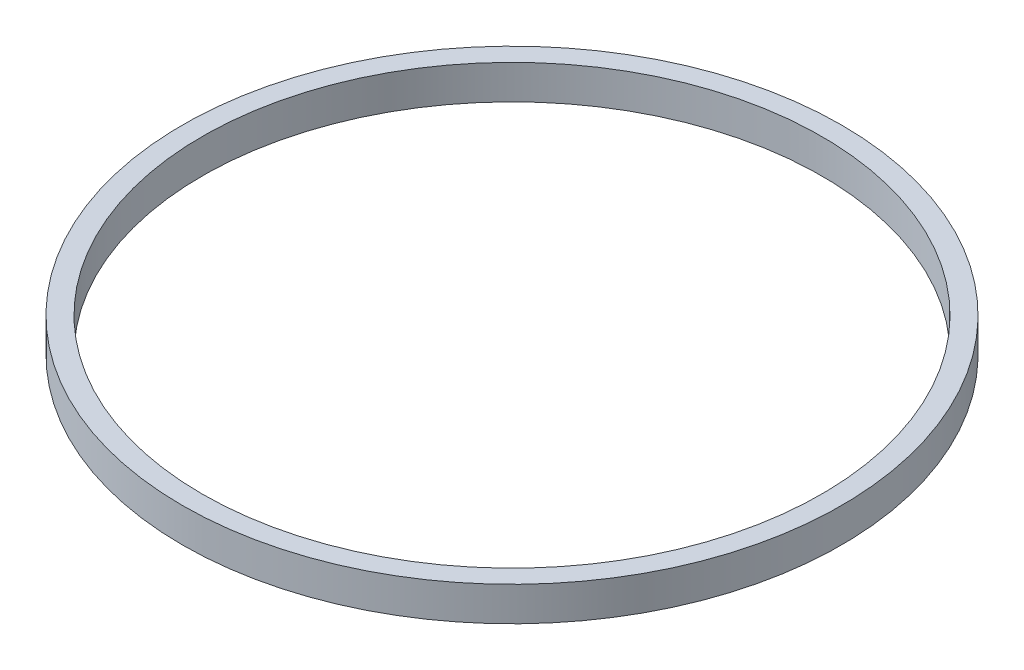
from build123d import *

# Parameters (mm, degrees)
SKETCH1_R           = 183
SKETCH1_R_2         = 172
BOSS_EXTRUDE1_DEPTH = 9.5


with BuildPart() as part:
    # Sketch1 → Boss-Extrude1 (new, symmetric)
    with BuildSketch(Plane(origin=(0, 0, 0), x_dir=(1, 0, 0), z_dir=(0, 1, 0))):
        with Locations(Location((0, 0, 0), (0, 0, 270))):
            Circle(SKETCH1_R)
        with Locations(Location((0, 0, 0), (0, 0, 270))):
            Circle(SKETCH1_R_2, mode=Mode.SUBTRACT)
    extrude(amount=BOSS_EXTRUDE1_DEPTH, both=True)


solid = part.part
